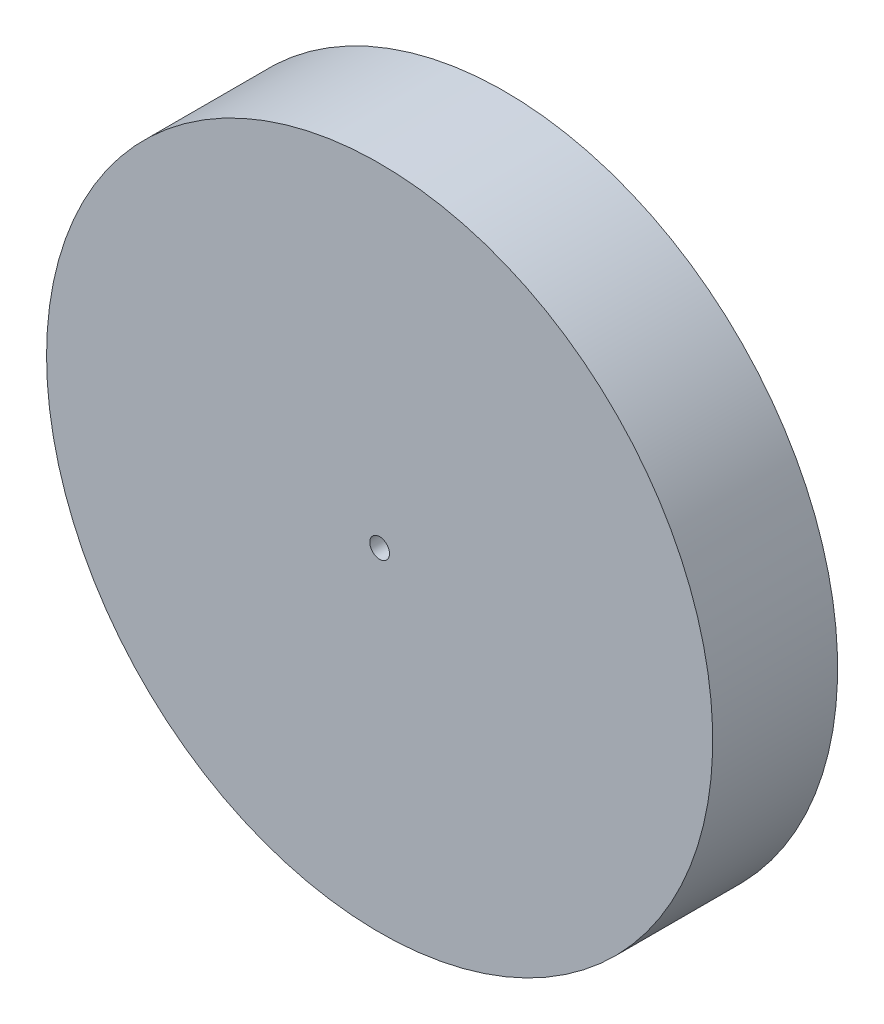
from build123d import *

# Parameters (mm, degrees)
SKETCH1_R                       = 50.8
BOSS_EXTRUDE1_DEPTH             = 19.05
F_3_0MM_CLEARANCE_DOWEL_HOLE1_D = 3


with BuildPart() as part:
    # Sketch1 → Boss-Extrude1 (new body)
    with BuildSketch(Plane.XY):
        with Locations(Location((0, 0, 0), (0, 0, 180))):
            Circle(SKETCH1_R)
    extrude(amount=BOSS_EXTRUDE1_DEPTH)

    # Ø3.0mm Clearance Dowel Hole1 (through all)
    with Locations(Plane.XY.offset(19.05)):
        with Locations((0, 0)):
            Hole(F_3_0MM_CLEARANCE_DOWEL_HOLE1_D / 2)


solid = part.part
